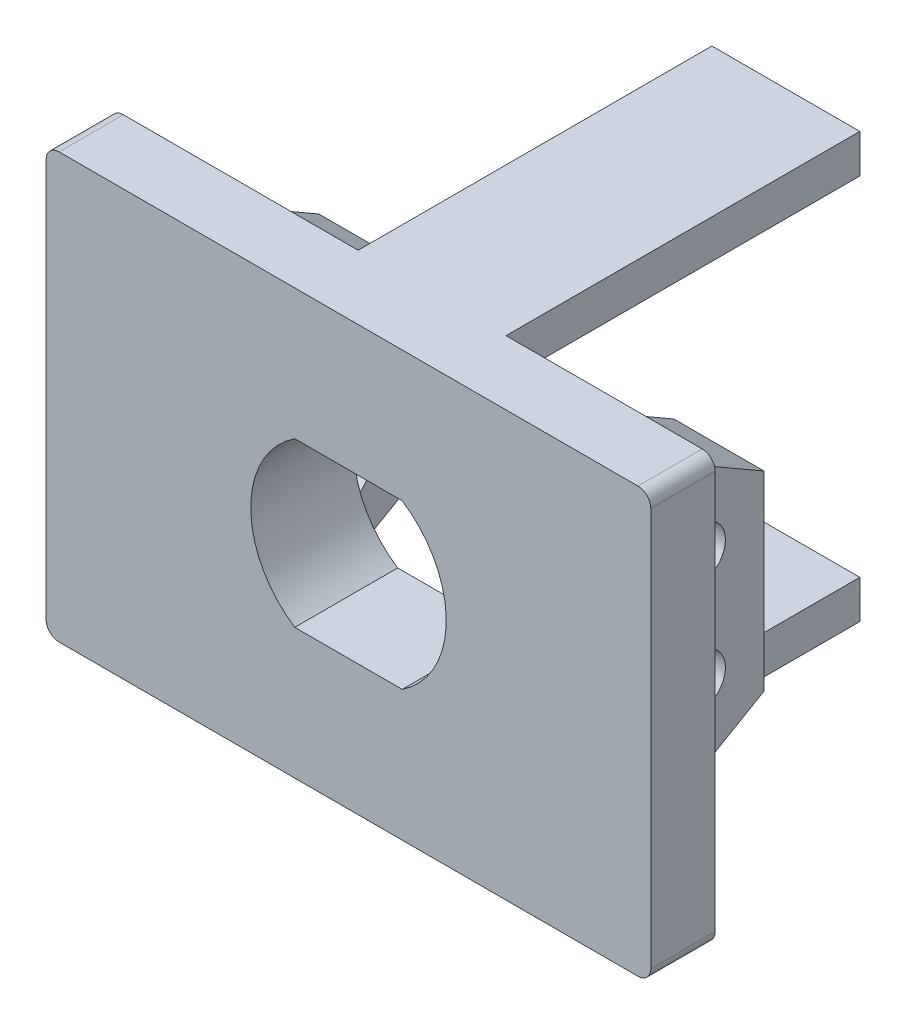
from build123d import *
from OCP.BRepFilletAPI import BRepFilletAPI_MakeChamfer

# Parameters (mm, degrees)
SZKIC1_W                    = 47
SZKIC1_H                    = 33
SZKIC1_R                    = 7.6
DODANIE_WYCI_GNI_CIE1_DEPTH = 5
SZKIC2_W                    = 7
SZKIC2_H                    = 20.6
DODANIE_WYCI_GNI_CIE2_DEPTH = 10
SFAZOWANIE1_SIZE            = 5
SFAZOWANIE1_SIZE2           = 2.886751346
SZKIC3_R                    = 2
WYTNIJ_WYCI_GNI_CIE1_DEPTH  = 46.131917752
ZAOKR_GLENIE1_R             = 1
SZKIC4_W                    = 11.5
SZKIC4_H                    = 3
SZKIC4_W_2                  = 12
SZKIC4_H_2                  = 2.980259267
DODANIE_WYCI_GNI_CIE3_DEPTH = 27.5
DODANIE_WYCI_GNI_CIE4_START = 3
SZKIC5_W                    = 20.6
SZKIC5_H                    = 20.6
DODANIE_WYCI_GNI_CIE4_DEPTH = 3


with BuildPart() as part:
    # Szkic1 → Dodanie-wyciągnięcie1 (new body)
    # profile 1 of 3: a face of its own
    with BuildSketch(Plane.XY):
        Rectangle(SZKIC1_W, SZKIC1_H)
        Circle(SZKIC1_R, mode=Mode.SUBTRACT)
    # profile 2 of 3: a face of its own
    with BuildSketch(Plane.XY):
        with BuildLine():
            Line((4.175823272, -6.35), (-4.175823272, -6.35))
            ThreePointArc((-4.175823272, -6.35), (0, -7.6), (4.175823272, -6.35))
        make_face()
    # profile 3 of 3: a face of its own
    with BuildSketch(Plane.XY):
        with BuildLine():
            ThreePointArc((4.175823272, 6.35), (0, 7.6), (-4.175823272, 6.35))
            Line((-4.175823272, 6.35), (4.175823272, 6.35))
        make_face()
    extrude(amount=DODANIE_WYCI_GNI_CIE1_DEPTH)

    # Szkic2 → Dodanie-wyciągnięcie2 (add)
    with BuildSketch(Plane(origin=(0, 0, 0), x_dir=(-1, 0, 0), z_dir=(0, 0, -1))):
        with Locations((-13.8, 0)):
            Rectangle(SZKIC2_W, SZKIC2_H)
        with Locations((13.8, 0)):
            Rectangle(SZKIC2_W, SZKIC2_H)
    extrude(amount=DODANIE_WYCI_GNI_CIE2_DEPTH)

    # Sfazowanie1: one chamfer whose edges measure the first distance from different faces: ONE call of the kernel's chamfer builder (chamfer() names one face for all edges)
    sfazowanie1_edges_1 = [part.edges().sort_by_distance(p)[0] for p in [
        (13.8, 10.3, -10),
    ]]
    sfazowanie1_side_1 = [part.faces().sort_by_distance(p)[0] for p in [
        (13.8, 10.3, -5),
    ]]
    sfazowanie1_edges_2 = [part.edges().sort_by_distance(p)[0] for p in [
        (13.8, -10.3, -10),
    ]]
    sfazowanie1_side_2 = [part.faces().sort_by_distance(p)[0] for p in [
        (13.8, -10.3, -5),
    ]]
    sfazowanie1_edges_3 = [part.edges().sort_by_distance(p)[0] for p in [
        (-13.8, 10.3, -10),
    ]]
    sfazowanie1_side_3 = [part.faces().sort_by_distance(p)[0] for p in [
        (-13.8, 10.3, -5),
    ]]
    sfazowanie1_edges_4 = [part.edges().sort_by_distance(p)[0] for p in [
        (-13.8, -10.3, -10),
    ]]
    sfazowanie1_side_4 = [part.faces().sort_by_distance(p)[0] for p in [
        (-13.8, -10.3, -5),
    ]]
    sfazowanie1 = BRepFilletAPI_MakeChamfer(part.part.solid().wrapped)
    for e in sfazowanie1_edges_1:
        sfazowanie1.Add(SFAZOWANIE1_SIZE, SFAZOWANIE1_SIZE2, e.wrapped, sfazowanie1_side_1[0].wrapped)  # the first distance lies on this face
    for e in sfazowanie1_edges_2:
        sfazowanie1.Add(SFAZOWANIE1_SIZE, SFAZOWANIE1_SIZE2, e.wrapped, sfazowanie1_side_2[0].wrapped)  # the first distance lies on this face
    for e in sfazowanie1_edges_3:
        sfazowanie1.Add(SFAZOWANIE1_SIZE, SFAZOWANIE1_SIZE2, e.wrapped, sfazowanie1_side_3[0].wrapped)  # the first distance lies on this face
    for e in sfazowanie1_edges_4:
        sfazowanie1.Add(SFAZOWANIE1_SIZE, SFAZOWANIE1_SIZE2, e.wrapped, sfazowanie1_side_4[0].wrapped)  # the first distance lies on this face
    add(Compound.cast(sfazowanie1.Shape()), mode=Mode.REPLACE)

    # Szkic3 → Wytnij-wyciągnięcie1 (cut, through all)
    with BuildSketch(Plane(origin=(17.3, 0, 0), x_dir=(0, 0, -1), z_dir=(1, 0, 0))):
        with Locations((5, 4.3)):
            Circle(SZKIC3_R)
        with Locations((5, -4.3)):
            Circle(SZKIC3_R)
    extrude(amount=-WYTNIJ_WYCI_GNI_CIE1_DEPTH, mode=Mode.SUBTRACT)

    # Zaokrąglenie1
    zaokr_glenie1_edges = [part.edges().sort_by_distance(p)[0] for p in [
        (-23.5, -16.5, 2.5),
        (-23.5, 16.5, 2.5),
        (23.5, 16.5, 2.5),
        (23.5, -16.5, 2.5),
    ]]
    fillet(zaokr_glenie1_edges, radius=ZAOKR_GLENIE1_R)

    # Szkic4 → Dodanie-wyciągnięcie3 (add)
    with BuildSketch(Plane(origin=(0, 0, 0), x_dir=(-1, 0, 0), z_dir=(0, 0, -1))):
        with Locations((-1.5, 15)):
            Rectangle(SZKIC4_W, SZKIC4_H)
        with Locations((-1.25, -15.009870366)):
            Rectangle(SZKIC4_W_2, SZKIC4_H_2)
    extrude(amount=DODANIE_WYCI_GNI_CIE3_DEPTH)

    # Szkic5 → Dodanie-wyciągnięcie4 (add)
    with BuildSketch(Plane(origin=(0, 0, 0), x_dir=(-1, 0, 0), z_dir=(0, 0, -1)).offset(DODANIE_WYCI_GNI_CIE4_START)):
        Rectangle(SZKIC5_W, SZKIC5_H)
        with BuildLine():
            Line((4.175823272, -6.35), (-4.175823272, -6.35))
            ThreePointArc((-4.175823272, -6.35), (-7.6, 0), (-4.175823272, 6.35))
            Line((-4.175823272, 6.35), (4.175823272, 6.35))
            ThreePointArc((4.175823272, 6.35), (7.6, 0), (4.175823272, -6.35))
        make_face(mode=Mode.SUBTRACT)
    extrude(amount=-DODANIE_WYCI_GNI_CIE4_DEPTH)


solid = part.part
